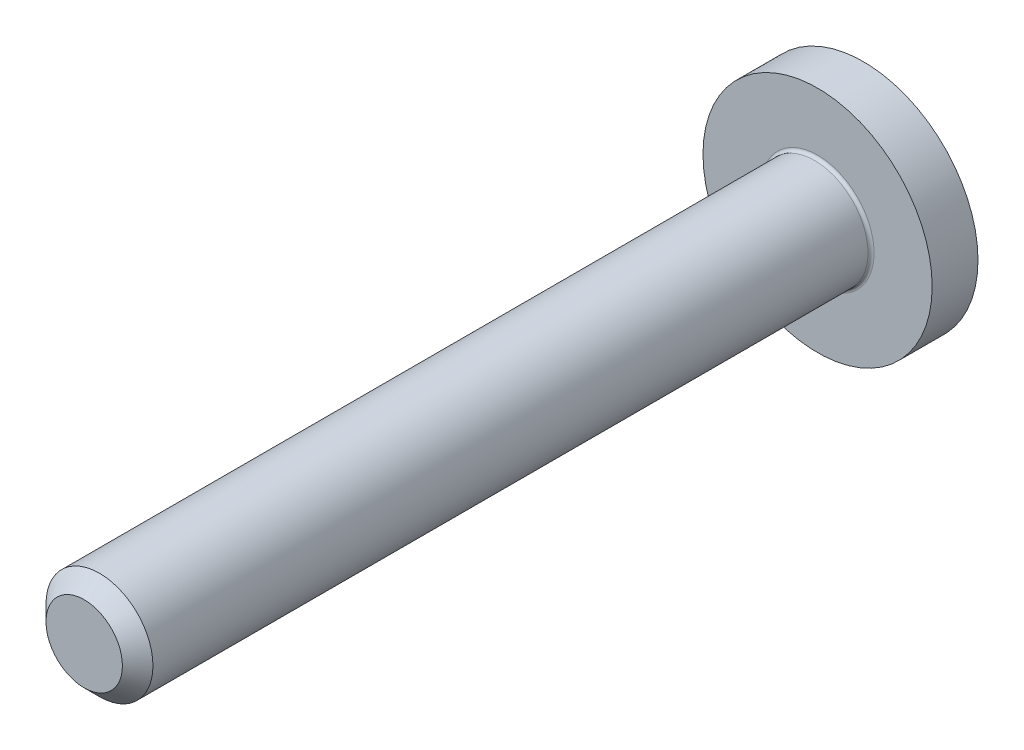
from build123d import *

# Parameters (mm, degrees)
SKETCH1_R           = 3.5
BOSS_EXTRUDE1_DEPTH = 48
SKETCH2_R           = 7.5
BOSS_EXTRUDE2_DEPTH = 3
CHAMFER1_SIZE       = 1
FILLET1_R           = 0.2


with BuildPart() as part:
    # Sketch1 → Boss-Extrude1 (new body)
    with BuildSketch(Plane.XY):
        Circle(SKETCH1_R)
    extrude(amount=BOSS_EXTRUDE1_DEPTH)

    # Sketch2 → Boss-Extrude2 (add)
    with BuildSketch(Plane(origin=(0, 0, 0), x_dir=(-1, 0, 0), z_dir=(0, 0, -1))):
        Circle(SKETCH2_R)
    extrude(amount=BOSS_EXTRUDE2_DEPTH)

    # Chamfer1
    chamfer1_edges = [part.edges().sort_by_distance(p)[0] for p in [
        (-3.5, 0, 48),
    ]]
    chamfer(chamfer1_edges, length=CHAMFER1_SIZE)

    # Fillet1
    fillet1_edges = [part.edges().sort_by_distance(p)[0] for p in [
        (-3.5, 0, 0),
    ]]
    fillet(fillet1_edges, radius=FILLET1_R)


solid = part.part
